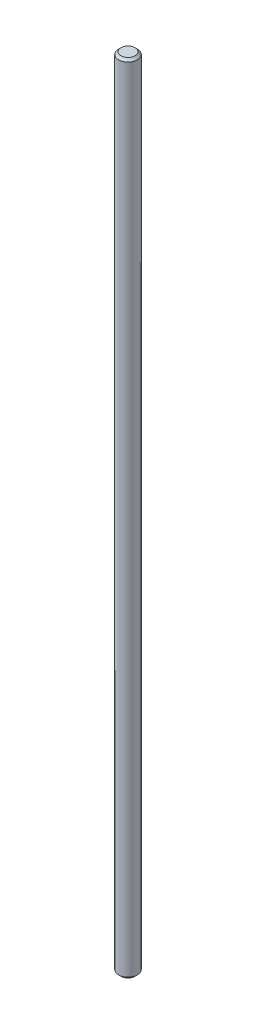
from build123d import *

# Parameters (mm, degrees)
SKETCH1_R           = 4
BOSS_EXTRUDE1_DEPTH = 340
CHAMFER1_SIZE       = 1


with BuildPart() as part:
    # Sketch1 → Boss-Extrude1 (new body)
    with BuildSketch(Plane(origin=(0, 340, 0), x_dir=(1, 0, 0), z_dir=(0, 1, 0))):
        with Locations(Location((0, 0, 0), (0, 0, 90))):
            Circle(SKETCH1_R)
    extrude(amount=-BOSS_EXTRUDE1_DEPTH)

    # Chamfer1
    chamfer1_edges = [part.edges().sort_by_distance(p)[0] for p in [
        (0, 340, 4),
        (0, 0, 4),
    ]]
    chamfer(chamfer1_edges, length=CHAMFER1_SIZE)


solid = part.part
